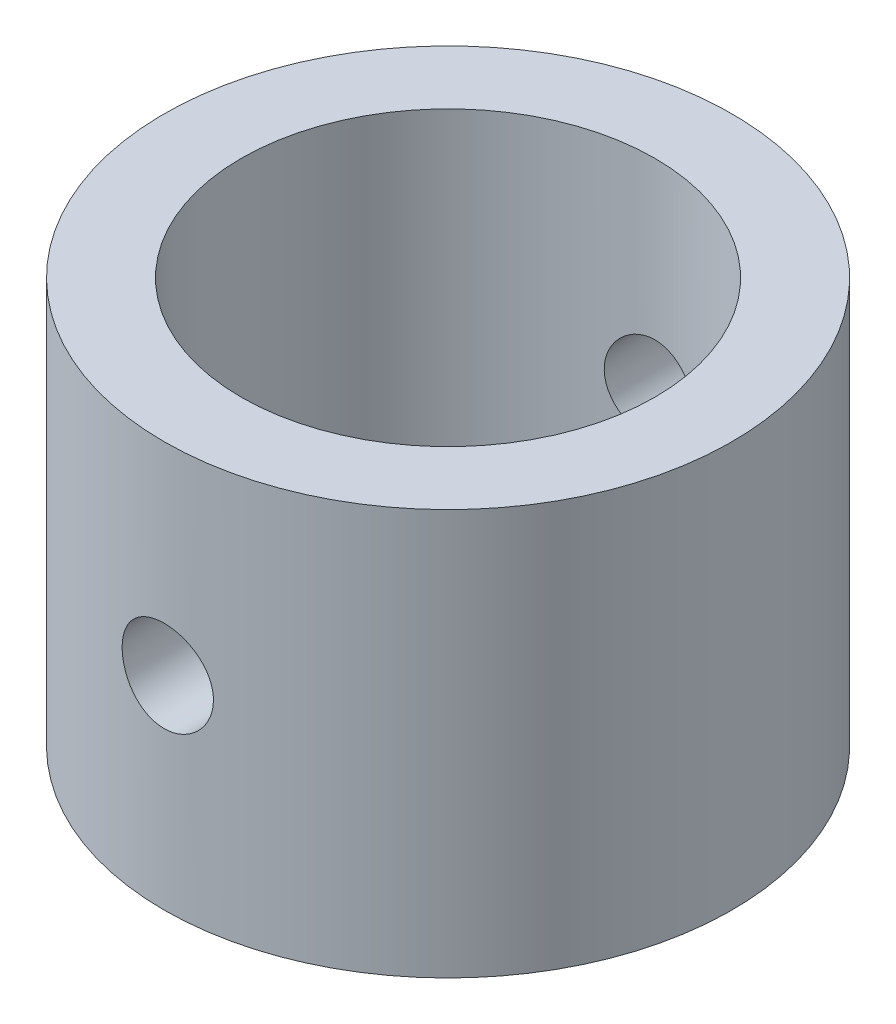
from build123d import *

# Parameters (mm, degrees)
SKETCH_1_R               = 14
SKETCH_1_R_2             = 10.2
EXTRUDE_1_DEPTH          = 10
CUT_EXTRUDE_1_DEPTH      = 23.181073013
CUT_EXTRUDE_1_DEPTH_BACK = 23.181073013
SKETCH_3_R               = 2.25


with BuildPart() as part:
    # Эскиз1 → Бобышка-Вытянуть1 (new, symmetric)
    with BuildSketch(Plane(origin=(0, 0, 0), x_dir=(1, 0, 0), z_dir=(0, 1, 0))):
        with Locations(Location((0, 0, 0), (0, 0, 270))):
            Circle(SKETCH_1_R)
        with Locations(Location((0, 0, 0), (0, 0, 270))):
            Circle(SKETCH_1_R_2, mode=Mode.SUBTRACT)
    extrude(amount=EXTRUDE_1_DEPTH, both=True)

    # Эскиз3 → Вырез-Вытянуть1 (cut, two sides: drawn at the far end of the back side and taken through both)
    with BuildSketch(Plane.XY.offset(-CUT_EXTRUDE_1_DEPTH_BACK)):
        Circle(SKETCH_3_R)
    extrude(amount=CUT_EXTRUDE_1_DEPTH + CUT_EXTRUDE_1_DEPTH_BACK, mode=Mode.SUBTRACT)


solid = part.part
